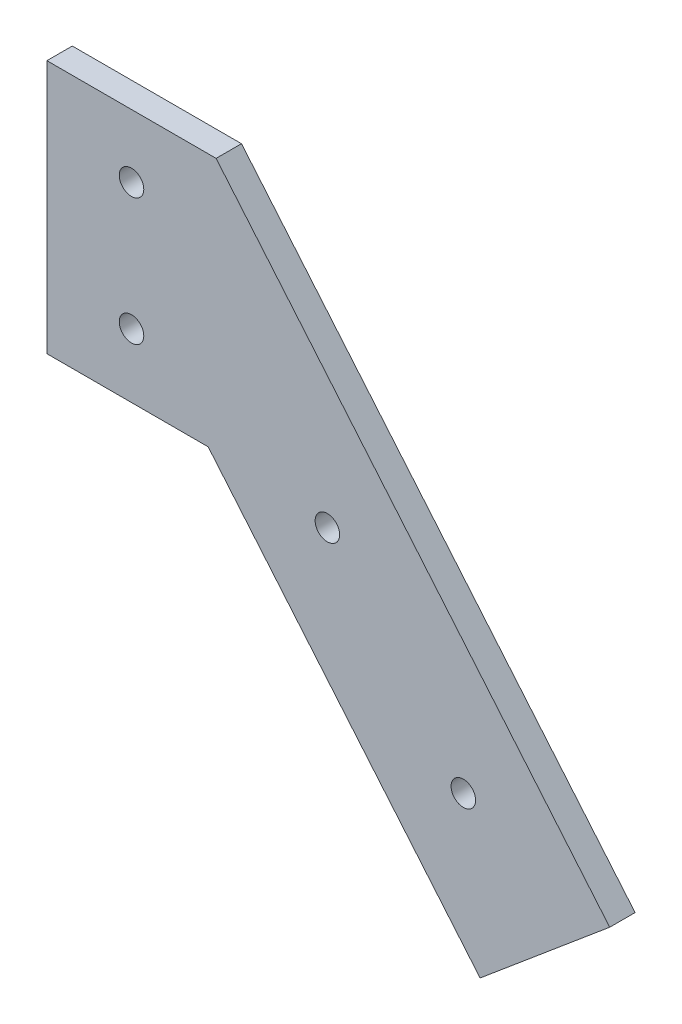
from build123d import *

# Parameters (mm, degrees)
SKETCH1_R           = 1.45
BOSS_EXTRUDE1_DEPTH = 3


with BuildPart() as part:
    # Sketch1 → Boss-Extrude1 (new body)
    with BuildSketch(Plane.XY):
        Polygon((20, 0), (66.525112495, -55.446469962), (51.204223633, -68.302222156), (19.064843149, -30), (0, -30), (0, 0), align=None)
        with Locations((10, -7.451655145)):
            Circle(SKETCH1_R, mode=Mode.SUBTRACT)
        with Locations((10, -22.451655145)):
            Circle(SKETCH1_R, mode=Mode.SUBTRACT)
        with Locations((49.222853919, -50.383679412)):
            Circle(SKETCH1_R, mode=Mode.SUBTRACT)
        with Locations((33.153163677, -31.232568334)):
            Circle(SKETCH1_R, mode=Mode.SUBTRACT)
    extrude(amount=BOSS_EXTRUDE1_DEPTH)


solid = part.part
